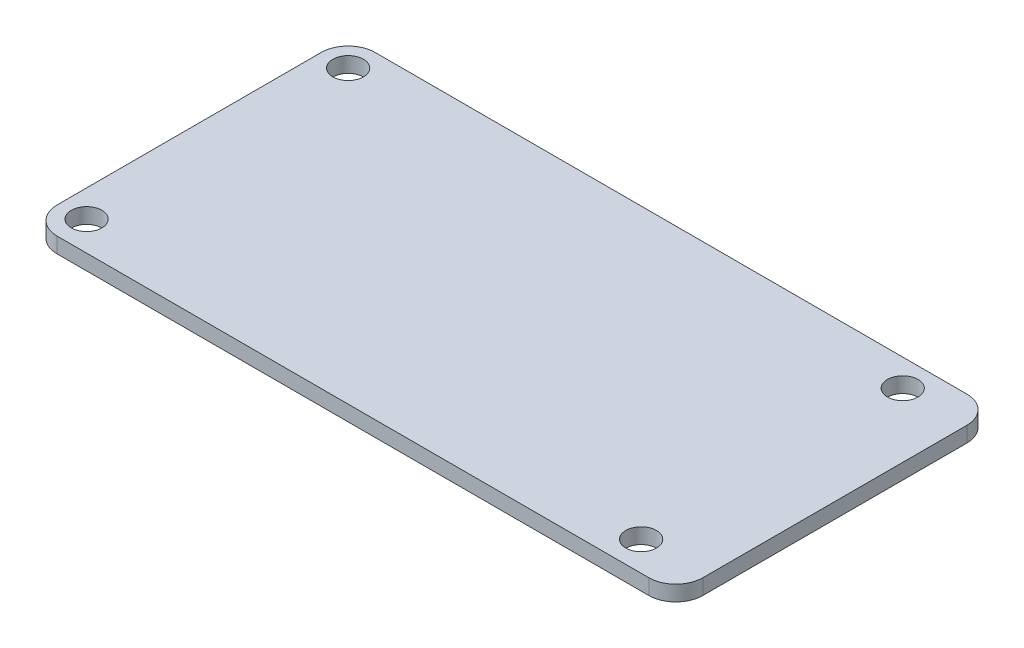
from build123d import *

# Parameters (mm, degrees)
SKETCH1_R           = 1.5875
BOSS_EXTRUDE1_DEPTH = 1.6


with BuildPart() as part:
    # Sketch1 → Boss-Extrude1 (new body)
    with BuildSketch(Plane(origin=(0, 0, 0), x_dir=(1, 0, 0), z_dir=(0, 1, 0))):
        with BuildLine():
            Line((-33.5, 13.697), (-33.5, -13.697))
            ThreePointArc((-33.5, -13.697), (-32.679020308, -15.679020308), (-30.697, -16.5))
            Line((-30.697, -16.5), (30.697, -16.5))
            ThreePointArc((30.697, -16.5), (32.679020308, -15.679020308), (33.5, -13.697))
            Line((33.5, -13.697), (33.5, 13.697))
            ThreePointArc((33.5, 13.697), (32.679020308, 15.679020308), (30.697, 16.5))
            Line((30.697, 16.5), (-30.697, 16.5))
            ThreePointArc((-30.697, 16.5), (-32.679020308, 15.679020308), (-33.5, 13.697))
        make_face()
        with Locations(Location((-30.697, 13.697, 0), (0, 0, 270))):
            Circle(SKETCH1_R, mode=Mode.SUBTRACT)
        with Locations(Location((26.843, 13.697, 0), (0, 0, 270))):
            Circle(SKETCH1_R, mode=Mode.SUBTRACT)
        with Locations(Location((26.843, -13.443, 0), (0, 0, 270))):
            Circle(SKETCH1_R, mode=Mode.SUBTRACT)
        with Locations(Location((-30.697, -13.443, 0), (0, 0, 270))):
            Circle(SKETCH1_R, mode=Mode.SUBTRACT)
    extrude(amount=BOSS_EXTRUDE1_DEPTH)


solid = part.part
